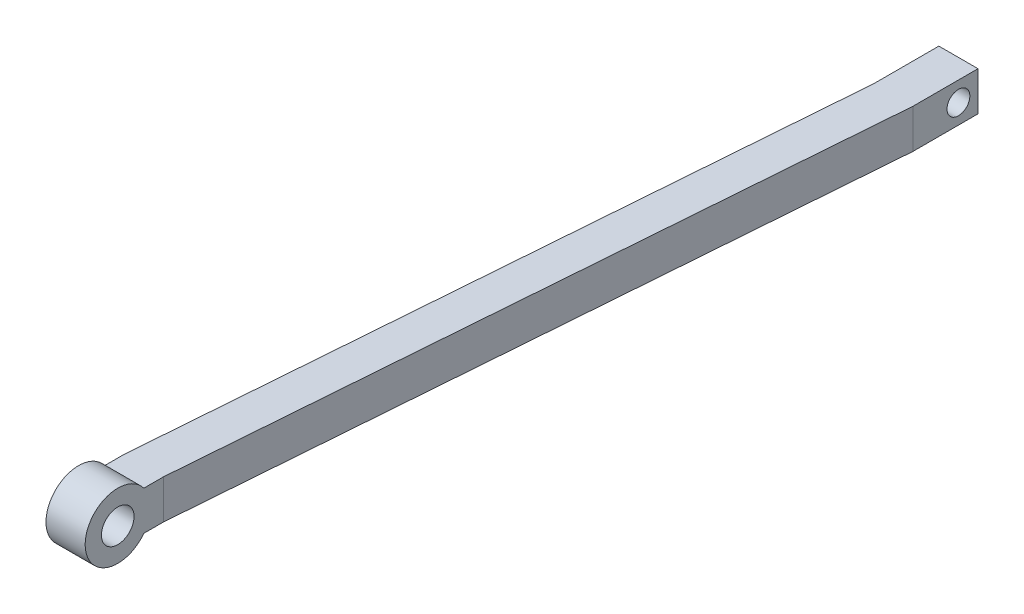
from build123d import *

# Parameters (mm, degrees)
BOSS_EXTRUDE1_DEPTH = 12
CUT_EXTRUDE3_REACH  = 251.216
SKETCH2_R           = 5
CUT_EXTRUDE4_REACH  = 251.216
SKETCH3_R           = 3.5
SKETCH4_R           = 10
SKETCH4_R_2         = 5
BOSS_EXTRUDE2_DEPTH = 12


with BuildPart() as part:
    # Sketch1 → Boss-Extrude1 (new body)
    with BuildSketch(Plane(origin=(0, 0, 0), x_dir=(1, 0, 0), z_dir=(0, 1, 0))):
        Polygon((10.5, 227.29), (22.5, 227.29), (6, 14), (-6, 14), align=None)
        Polygon((22.5, 227.29), (22.5, 241.29), (22.5, 247.29), (16.5, 247.29), (10.5, 247.29), (10.5, 227.29), align=None)
        Polygon((6, -6), (6, 14), (-6, 14), (-6, 0), (-6, -6), (0, -6), align=None)
    extrude(amount=-BOSS_EXTRUDE1_DEPTH)

    # Sketch2 → Cut-Extrude3 (cut, up to next)
    with BuildSketch(Plane.ZY.offset(6), mode=Mode.PRIVATE) as cut_extrude3_sk1:
        with Locations((0, -6)):
            Circle(SKETCH2_R)
    cut_extrude3_tool1 = extrude(cut_extrude3_sk1.sketch, amount=-CUT_EXTRUDE3_REACH, mode=Mode.PRIVATE) & part.part
    add(cut_extrude3_tool1.solids().sort_by_distance((-6, -6, 0))[0], mode=Mode.SUBTRACT)

    # Sketch3 → Cut-Extrude4 (cut, up to next)
    with BuildSketch(Plane(origin=(22.5, 0, 0), x_dir=(0, 0, -1), z_dir=(1, 0, 0)), mode=Mode.PRIVATE) as cut_extrude4_sk1:
        with Locations((241.29, -6)):
            Circle(SKETCH3_R)
    cut_extrude4_tool1 = extrude(cut_extrude4_sk1.sketch, amount=-CUT_EXTRUDE4_REACH, mode=Mode.PRIVATE) & part.part
    add(cut_extrude4_tool1.solids().sort_by_distance((22.5, -6, -241.29))[0], mode=Mode.SUBTRACT)

    # Sketch4 → Boss-Extrude2 (add)
    with BuildSketch(Plane.ZY.offset(6)):
        with Locations((0, -6)):
            Circle(SKETCH4_R)
        with Locations((0, -6)):
            Circle(SKETCH4_R_2, mode=Mode.SUBTRACT)
    extrude(amount=-BOSS_EXTRUDE2_DEPTH)


solid = part.part
